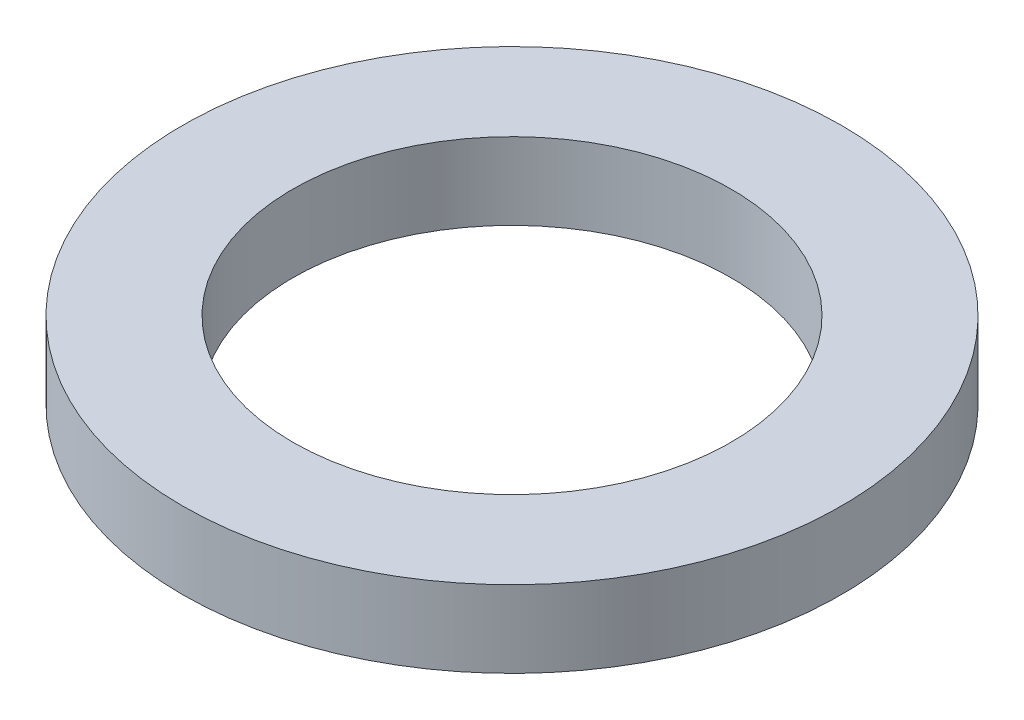
from build123d import *

# Parameters (mm, degrees)
SKETCH1_W = 13.6779
SKETCH1_H = 9.525


with BuildPart() as part:
    # Sketch1 → Revolve1 (revolve)
    with BuildSketch(Plane.XY):
        with Locations((34.01695, -4.7625)):
            Rectangle(SKETCH1_W, SKETCH1_H)
    revolve(axis=Axis((0, 22.709640493, 0), (0, -1, 0)))


solid = part.part
